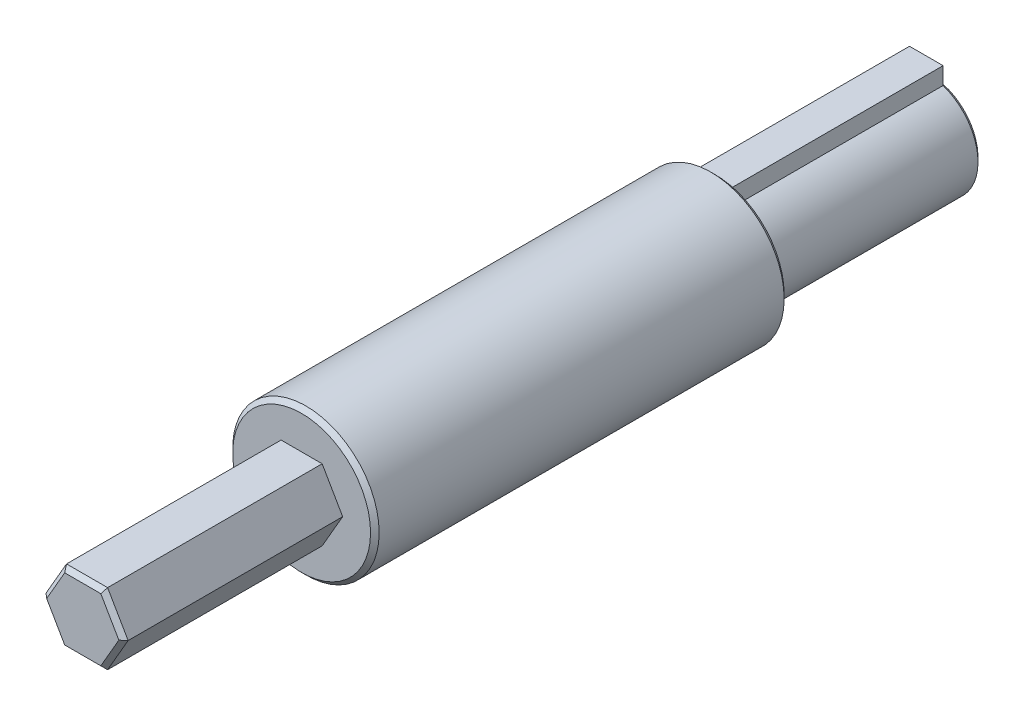
from build123d import *

# Parameters (mm, degrees)
SKETCH2_R           = 6
BOSS_EXTRUDE1_DEPTH = 25.4
BOSS_EXTRUDE2_START = 25
BOSS_EXTRUDE2_DEPTH = 25
SKETCH4_R           = 8.5
BOSS_EXTRUDE3_DEPTH = 48
BOSS_EXTRUDE4_DEPTH = 25.4
CHAMFER1_SIZE       = 0.5


with BuildPart() as part:
    # Sketch2 → Boss-Extrude1 (new body)
    with BuildSketch(Plane.XY):
        Circle(SKETCH2_R)
    extrude(amount=BOSS_EXTRUDE1_DEPTH)

    # Sketch3 → Boss-Extrude2 (add)
    with BuildSketch(Plane(origin=(0, 0, 0), x_dir=(-1, 0, 0), z_dir=(0, 0, -1)).offset(BOSS_EXTRUDE2_START)):
        with BuildLine():
            Line((-1.95, 5.674284096), (-1.95, 7.674284096))
            Line((-1.95, 7.674284096), (1.95, 7.674284096))
            Line((1.95, 7.674284096), (1.95, 5.674284096))
            ThreePointArc((1.95, 5.674284096), (0, -6), (-1.95, 5.674284096))
        make_face()
    extrude(amount=-BOSS_EXTRUDE2_DEPTH)

    # Sketch4 → Boss-Extrude3 (add)
    with BuildSketch(Plane.XY):
        Circle(SKETCH4_R)
    extrude(amount=BOSS_EXTRUDE3_DEPTH)

    # Sketch5 → Boss-Extrude4 (add)
    with BuildSketch(Plane.XY.offset(48)):
        Polygon((4.766026472, 0), (2.383013236, 4.1275), (-2.383013236, 4.1275), (-4.766026472, 0), (-2.383013236, -4.1275), (2.383013236, -4.1275), align=None)
    extrude(amount=BOSS_EXTRUDE4_DEPTH)

    # Chamfer1
    chamfer1_edges = [part.edges().sort_by_distance(p)[0] for p in [
        (-8.5, 0, 0),
        (-8.5, 0, 48),
        (3.574519854, -2.06375, 73.4),
        (3.574519854, 2.06375, 73.4),
        (0, 4.1275, 73.4),
        (-3.574519854, 2.06375, 73.4),
        (-3.574519854, -2.06375, 73.4),
        (0, -4.1275, 73.4),
        (0, -6, -25),
        (-1.95, 6.674284096, -25),
        (0, 7.674284096, -25),
        (1.95, 6.674284096, -25),
    ]]
    chamfer(chamfer1_edges, length=CHAMFER1_SIZE)


solid = part.part
